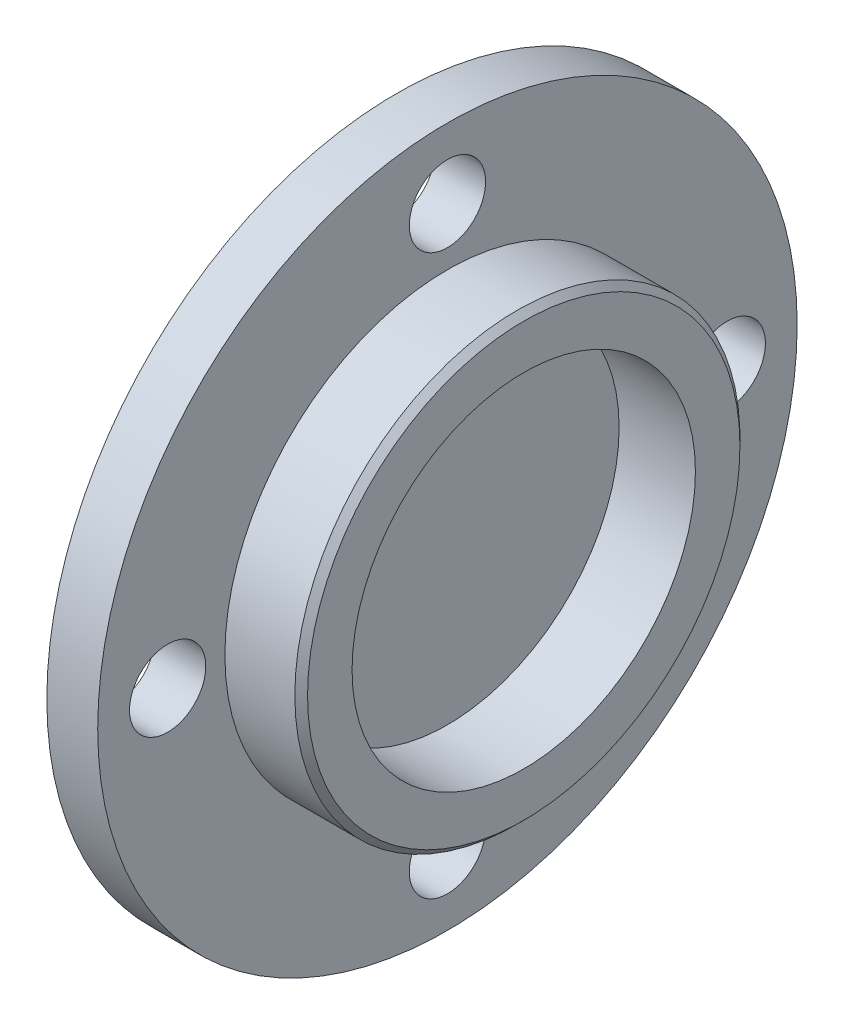
from build123d import *

# Parameters (mm, degrees)
CHAMFER1_SIZE      = 0.5
SKETCH3_R          = 3
CUT_EXTRUDE1_DEPTH = 41.155946011


with BuildPart() as part:
    # Sketch1 → Revolve2 (revolve)
    with BuildSketch(Plane(origin=(0, 0, 0), x_dir=(1, 0, 0), z_dir=(0, 1, 0)), mode=Mode.PRIVATE) as revolve2_sk:
        Polygon((0, 0), (0, 27.5), (4, 27.5), (4, 17.5), (10, 17.5), (10, 13.5), (4, 13.5), (4, 0), align=None)
    revolve(revolve2_sk.sketch.rotate(Axis((0, 0, 0), (1, 0, 0)), 180), axis=Axis((0, 0, 0), (1, 0, 0)))

    # Chamfer1
    chamfer1_edges = [part.edges().sort_by_distance(p)[0] for p in [
        (10, 0, -17.5),
    ]]
    chamfer(chamfer1_edges, length=CHAMFER1_SIZE)

    # Sketch3 → Cut-Extrude1 (cut, through all)
    with BuildSketch(Plane.ZY):
        with Locations((0, 22)):
            Circle(SKETCH3_R)
        with Locations((22, 0)):
            Circle(SKETCH3_R)
        with Locations((0, -22)):
            Circle(SKETCH3_R)
        with Locations((-22, 0)):
            Circle(SKETCH3_R)
    extrude(amount=-CUT_EXTRUDE1_DEPTH, mode=Mode.SUBTRACT)


solid = part.part
